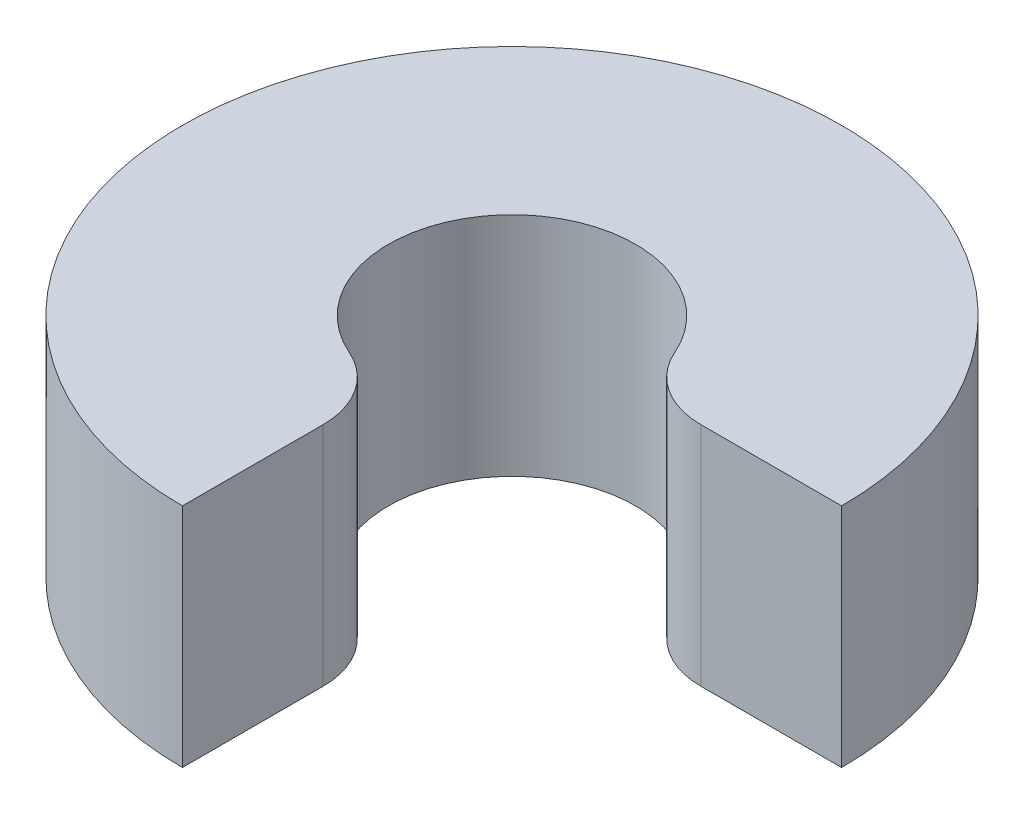
from build123d import *

# Parameters (mm, degrees)
SALIENTE_EXTRUIR1_DEPTH = 2.75
REDONDEO1_R             = 1


with BuildPart() as part:
    # Croquis1 → Saliente-Extruir1 (new body)
    with BuildSketch(Plane(origin=(0, 0, 0), x_dir=(1, 0, 0), z_dir=(0, 1, 0))):
        with BuildLine():
            Line((1.5, 0), (4, 0))
            ThreePointArc((4, 0), (-2.828427125, 2.828427125), (0, -4))
            Line((0, -4), (0, -1.5))
            ThreePointArc((0, -1.5), (-1.060660172, 1.060660172), (1.5, 0))
        make_face()
    extrude(amount=SALIENTE_EXTRUIR1_DEPTH)

    # Redondeo1
    redondeo1_edges = [part.edges().sort_by_distance(p)[0] for p in [
        (0, 1.375, 1.5),
        (1.5, 1.375, 0),
    ]]
    fillet(redondeo1_edges, radius=REDONDEO1_R)


solid = part.part
